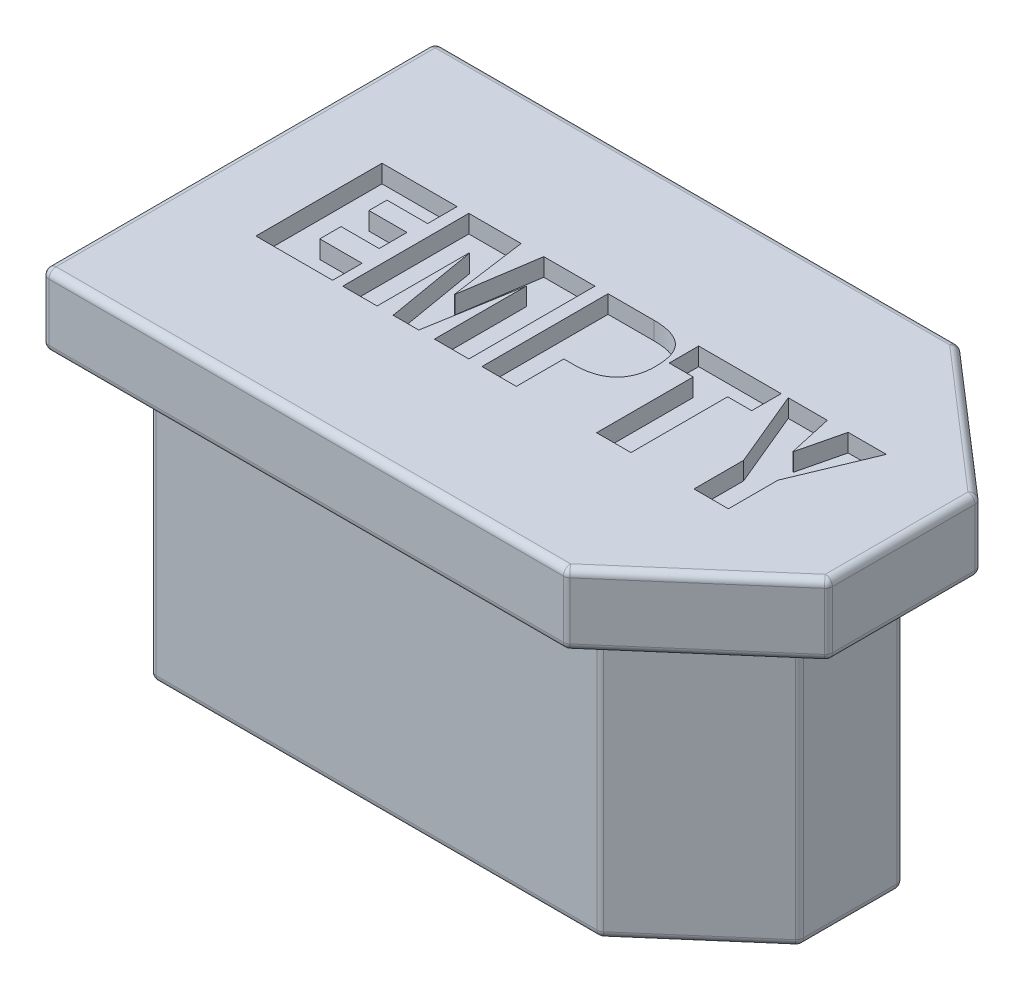
from build123d import *

# Parameters (mm, degrees)
BOSS_EXTRUDE1_DEPTH = 4
SHELL1_T            = -0.8
BOSS_EXTRUDE2_DEPTH = 2
BOSS_EXTRUDE4_REACH = 16.722
SKETCH4_W           = 2
SKETCH4_H           = 1.2
SKETCH5_W           = 1.1
SKETCH5_H           = 4
CUT_EXTRUDE1_DEPTH  = 1
FILLET1_R           = 0.2
CUT_EXTRUDE2_DEPTH  = 0.5


with BuildPart() as part:
    # Sketch1 → Boss-Extrude1 (new, symmetric)
    with BuildSketch(Plane(origin=(0, 0, 0), x_dir=(1, 0, 0), z_dir=(0, 1, 0))):
        Polygon((-7.800231879, 4), (4.799768121, 4), (7.800231879, 1.4), (7.800231879, -1.4), (4.799768121, -4), (-7.800231879, -4), align=None)
    extrude(amount=BOSS_EXTRUDE1_DEPTH, both=True)

    # Shell1
    shell1_openings = [part.faces().sort_by_distance(p)[0] for p in [
        (-0.453398861, 4, 0),
        (-0.453398861, -4, 0),
    ]]
    offset(amount=SHELL1_T, openings=shell1_openings, kind=Kind.INTERSECTION)

    # Sketch2 → Boss-Extrude2 (add)
    with BuildSketch(Plane(origin=(0, 4, 0), x_dir=(1, 0, 0), z_dir=(0, 1, 0))):
        Polygon((-9.300231879, 5.5), (-9.300231879, -5.5), (5.359252751, -5.5), (9.300231879, -2.085012665), (9.300231879, 2.085012665), (5.359252751, 5.5), align=None)
    extrude(amount=BOSS_EXTRUDE2_DEPTH)

    # Sketch4 → Boss-Extrude4 (add, up to next)
    with BuildSketch(Plane.XZ.offset(4), mode=Mode.PRIVATE) as boss_extrude4_sk1:
        with Locations((-0.000231879, -2.6)):
            Rectangle(SKETCH4_W, SKETCH4_H)
    boss_extrude4_tool1 = extrude(boss_extrude4_sk1.sketch, amount=-BOSS_EXTRUDE4_REACH, mode=Mode.PRIVATE) - part.part
    add(boss_extrude4_tool1.solids().sort_by_distance((-0.000232, -4, -2.6))[0])

    # Sketch5 → Cut-Extrude1 (cut)
    with BuildSketch(Plane.XZ.offset(-4)):
        with Locations((-0.000231879, 0)):
            Rectangle(SKETCH5_W, SKETCH5_H)
    extrude(amount=-CUT_EXTRUDE1_DEPTH, mode=Mode.SUBTRACT)

    # Fillet1
    fillet1_edges = [part.edges().sort_by_distance(p)[0] for p in [
        (6.3, 4, 2.7),
        (-7.800231879, 0, -4),
        (4.799768121, 0, -4),
        (7.800231879, 0, -1.4),
        (7.800231879, 0, 1.4),
        (4.799768121, 0, 4),
        (-7.800231879, 0, 4),
        (7.800231879, 4, 0),
        (6.3, 4, -2.7),
        (-1.500231879, 4, -4),
        (-7.000231879, -4, 0),
        (-7.000231879, 0, -3.2),
        (-1.249427781, -4, 3.2),
        (-7.000231879, 0, 3.2),
        (5.750804099, -4, 2.117329956),
        (4.501376318, 0, 3.2),
        (7.000231879, -4, 0),
        (7.000231879, 0, 1.034659912),
        (5.750804099, -4, -2.117329956),
        (7.000231879, 0, -1.034659912),
        (2.750572219, -4, -3.2),
        (4.501376318, 0, -3.2),
        (-7.000231879, 4, 0),
        (-1.249427781, 4, 3.2),
        (5.750804099, 4, 2.117329956),
        (7.000231879, 4, 0),
        (5.750804099, 4, -2.117329956),
        (2.750572219, 4, -3.2),
        (-1.970489564, 4, -5.5),
        (5.359252751, 5, -5.5),
        (-9.300231879, 4, 0),
        (-9.300231879, 5, -5.5),
        (-1.970489564, 4, 5.5),
        (-9.300231879, 5, 5.5),
        (7.329742315, 4, 3.792506333),
        (5.359252751, 5, 5.5),
        (9.300231879, 4, 0),
        (9.300231879, 5, 2.085012665),
        (7.329742315, 4, -3.792506333),
        (9.300231879, 5, -2.085012665),
        (-1.970489564, 6, -5.5),
        (-9.300231879, 6, 0),
        (-1.970489564, 6, 5.5),
        (7.329742315, 6, 3.792506333),
        (-7.800231879, 4, 0),
        (9.300231879, 6, 0),
        (7.329742315, 6, -3.792506333),
        (-4.000231879, 4, -3.2),
        (-1.500231879, -4, -4),
        (-4.000231879, -4, -3.2),
        (0.999768121, 0, -3.2),
        (-1.000231879, 4, -2.6),
        (-1.000231879, 0, -3.2),
        (0.774768121, 4, -2),
        (-1.000231879, 0, -2),
        (0.999768121, 4, -2.6),
        (0.999768121, 0, -2),
        (0.999768121, -4, -2.6),
        (-0.000231879, -4, -2),
        (-1.000231879, -4, -2.6),
        (6.3, -4, -2.7),
        (7.800231879, -4, 0),
        (-1.500231879, 4, 4),
        (6.3, -4, 2.7),
        (-0.775231879, 4, -2),
        (-1.500231879, -4, 4),
        (-0.000231879, 5, -2),
        (0.549768121, 4.5, -2),
        (-0.550231879, 5, 0),
        (-0.550231879, 4.5, -2),
        (-0.000231879, 5, 2),
        (-0.550231879, 4.5, 2),
        (0.549768121, 5, 0),
        (0.549768121, 4.5, 2),
        (0.549768121, 4, 0),
        (-0.000231879, 4, 2),
        (-0.550231879, 4, 0),
        (-7.800231879, -4, 0),
    ]]
    fillet(fillet1_edges, radius=FILLET1_R)

    # Sketch6 → Cut-Extrude2 (cut)
    with BuildSketch(Plane(origin=(0, 6, 0), x_dir=(1, 0, 0), z_dir=(0, 1, 0))):
        Polygon((-7.050360511, 1.763183333), (-4.950855682, 1.763183333), (-4.950855682, 0.938837879), (-6.088624148, 0.938837879), (-6.088624148, 0.435071212), (-5.025275758, 0.435071212), (-5.025275758, -0.343477273), (-6.088624148, -0.343477273), (-6.088624148, -0.938837879), (-4.906489867, -0.938837879), (-4.906489867, -1.763183333), (-7.050360511, -1.763183333), align=None)
        Polygon((-4.623121117, 1.763183333), (-3.161911553, 1.763183333), (-2.864946828, -0.389274242), (-2.854928741, -0.389274242), (-2.527194176, 1.763183333), (-1.096754451, 1.763183333), (-1.096754451, -1.763183333), (-2.058490814, -1.763183333), (-2.058490814, 0.808602746), (-2.496424337, -1.763183333), (-3.213433144, -1.763183333), (-3.651366667, 0.808602746), (-3.661384754, 0.808602746), (-3.661384754, -1.763183333), (-4.623121117, -1.763183333), align=None)
        with BuildLine():
            Line((-0.730378693, 1.763183333), (0.552652036, 1.763183333))
            add(Edge.make_bspline(
                [(0.552652036, 1.763183333), (0.641745263, 1.76229429), (0.771771867, 1.756812309), (0.937988563, 1.7296027), (1.049628527, 1.700819461), (1.153036234, 1.665454828), (1.247196621, 1.620791385), (1.332910955, 1.568640081), (1.40985321, 1.507890868), (1.477930038, 1.43798182), (1.536147356, 1.357461688), (1.585828883, 1.267090986), (1.626476651, 1.166434928), (1.657817768, 1.055566045), (1.687828585, 0.888418902), (1.69592351, 0.756866907), (1.695429545, 0.666202794)],
                knots=[0, 0, 0, 0, 0.146362964, 0.213050913, 0.276108881, 0.335424675, 0.392172577, 0.446835693, 0.499792168, 0.552680565, 0.606484305, 0.662389797, 0.721576216, 0.78428799, 0.851179087, 1, 1, 1, 1], degree=3))
            add(Edge.make_bspline(
                [(1.695429545, 0.666202794), (1.694306332, 0.574673008), (1.687218248, 0.441271543), (1.649503939, 0.273724158), (1.611879134, 0.163357502), (1.562857383, 0.064044652), (1.507670199, -0.027155961), (1.441481133, -0.107785991), (1.36767856, -0.179759564), (1.285683485, -0.241976571), (1.196711595, -0.295553107), (1.100375454, -0.339833244), (0.997225536, -0.375345936), (0.888265761, -0.402619817), (0.733370245, -0.426775799), (0.61430217, -0.436438725), (0.533331439, -0.435071212)],
                knots=[0, 0, 0, 0, 0.150663008, 0.218160378, 0.281611966, 0.341726761, 0.399797705, 0.456348045, 0.512604347, 0.568800563, 0.625051405, 0.682910411, 0.742644659, 0.804042171, 0.86717714, 1, 1, 1, 1], degree=3))
            Line((0.533331439, -0.435071212), (0.23135767, -0.435071212))
            Line((0.23135767, -0.435071212), (0.23135767, -1.763183333))
            Line((0.23135767, -1.763183333), (-0.730378693, -1.763183333))
            Line((-0.730378693, -1.763183333), (-0.730378693, 1.763183333))
        make_face()
        Polygon((1.802766193, 1.763183333), (4.109788542, 1.763183333), (4.109788542, 0.938837879), (3.437145549, 0.938837879), (3.437145549, -1.763183333), (2.475409186, -1.763183333), (2.475409186, 0.938837879), (1.802766193, 0.938837879), align=None)
        Polygon((5.982003078, 1.763183333), (7.050360511, 1.763183333), (6.160181913, -0.375678267), (6.160181913, -1.763183333), (5.198445549, -1.763183333), (5.198445549, -0.375678267), (4.308266951, 1.763183333), (5.400238447, 1.763183333), (5.674304687, 0.531674195), (5.684322775, 0.531674195), align=None)
    extrude(amount=-CUT_EXTRUDE2_DEPTH, mode=Mode.SUBTRACT)


solid = part.part
